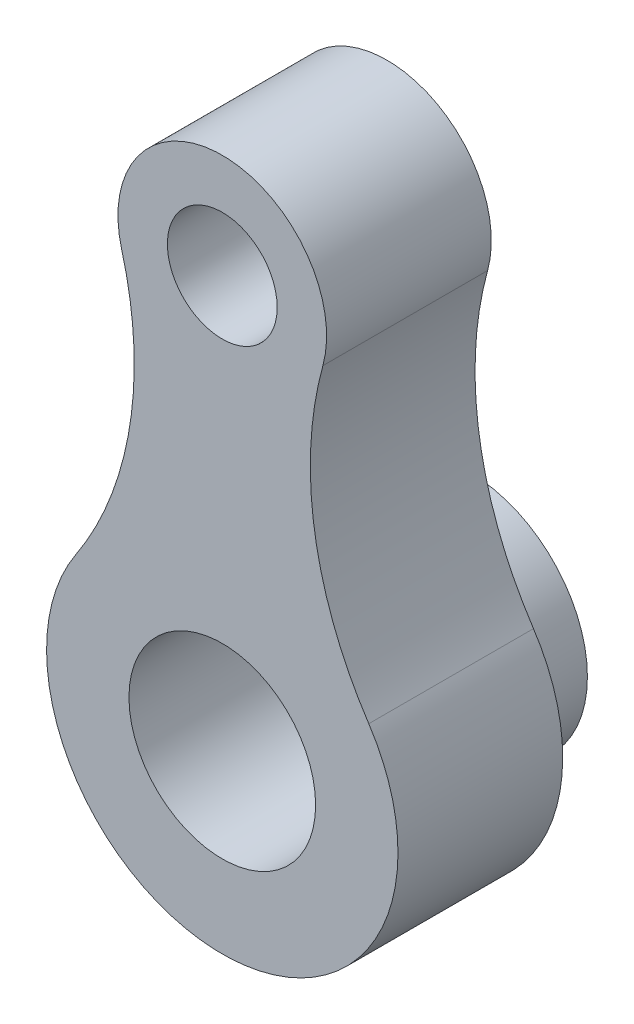
from build123d import *

# Parameters (mm, degrees)
Y_KSEKLIK_EKSTR_ZYON1_DEPTH      = 15
Y_KSEKLIK_EKSTR_ZYON1_DEPTH_BACK = 15
KES_EKSTR_ZYON2_START            = -10
IZIM1_8_R                        = 27.5
IZIM1_8_R_2                      = 21.5
KES_EKSTR_ZYON2_DEPTH            = 39
IZIM1_11_R                       = 21.5
Y_KSEKLIK_EKSTR_ZYON4_DEPTH      = 30
KES_EKSTR_ZYON3_DEPTH            = 26
KES_EKSTR_ZYON3_DEPTH_BACK       = 47
IZIM1_12_R                       = 17
KES_EKSTR_ZYON4_DEPTH            = 47
KES_EKSTR_ZYON4_DEPTH_BACK       = 47
IZIM1_13_R                       = 10


with BuildPart() as part:
    # Çizim1 → Yükseklik-Ekstrüzyon1 (new, two sides: drawn at the far end of the back side and taken through both)
    with BuildSketch(Plane.XY.offset(-Y_KSEKLIK_EKSTR_ZYON1_DEPTH_BACK)):
        with BuildLine():
            ThreePointArc((-26.678302647, -12.37237703), (0, -62.043488141), (26.678302647, -12.37237703))
            ThreePointArc((26.678302647, -12.37237703), (16.836772686, 12.870553113), (18.321243986, 39.923419489))
            ThreePointArc((18.321243986, 39.923419489), (0, 63.956511859), (-18.321243986, 39.923419489))
            ThreePointArc((-18.321243986, 39.923419489), (-16.836772686, 12.870553113), (-26.678302647, -12.37237703))
        make_face()
    extrude(amount=Y_KSEKLIK_EKSTR_ZYON1_DEPTH + Y_KSEKLIK_EKSTR_ZYON1_DEPTH_BACK)

    # Çizim1<8> → Kes-Ekstrüzyon2 (cut)
    with BuildSketch(Plane.XY.offset(KES_EKSTR_ZYON2_START)):
        with Locations((0, -30.043488141)):
            Circle(IZIM1_8_R)
        with Locations((0, -30.043488141)):
            Circle(IZIM1_8_R_2, mode=Mode.SUBTRACT)
    extrude(amount=-KES_EKSTR_ZYON2_DEPTH, mode=Mode.SUBTRACT)

    # Çizim1<11> → Yükseklik-Ekstrüzyon4 (add)
    with BuildSketch(Plane.XY):
        with Locations((0, -30.043488141)):
            Circle(IZIM1_11_R)
    extrude(amount=-Y_KSEKLIK_EKSTR_ZYON4_DEPTH)

    # Çizim1<12> → Kes-Ekstrüzyon3 (cut, two sides: drawn at the far end of the back side and taken through both)
    with BuildSketch(Plane.XY.offset(-KES_EKSTR_ZYON3_DEPTH_BACK)):
        with Locations((0, -30.043488141)):
            Circle(IZIM1_12_R)
    extrude(amount=KES_EKSTR_ZYON3_DEPTH + KES_EKSTR_ZYON3_DEPTH_BACK, mode=Mode.SUBTRACT)

    # Çizim1<13> → Kes-Ekstrüzyon4 (cut, two sides: drawn at the far end of the back side and taken through both)
    with BuildSketch(Plane.XY.offset(-KES_EKSTR_ZYON4_DEPTH_BACK)):
        with Locations((0, 44.956511859)):
            Circle(IZIM1_13_R)
    extrude(amount=KES_EKSTR_ZYON4_DEPTH + KES_EKSTR_ZYON4_DEPTH_BACK, mode=Mode.SUBTRACT)


solid = part.part
